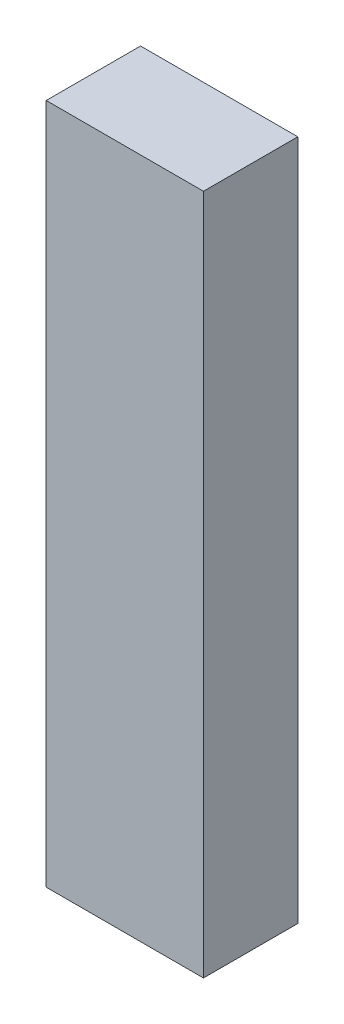
from build123d import *

# Parameters (mm, degrees)
ESQUISSE1_W      = 15
ESQUISSE1_H      = 65
EXTRUSION1_DEPTH = 9


with BuildPart() as part:
    # Esquisse1 → Extrusion1 (new body)
    with BuildSketch(Plane.XY):
        with Locations((19.776876457, 24.029316239)):
            Rectangle(ESQUISSE1_W, ESQUISSE1_H)
    extrude(amount=EXTRUSION1_DEPTH)


solid = part.part
